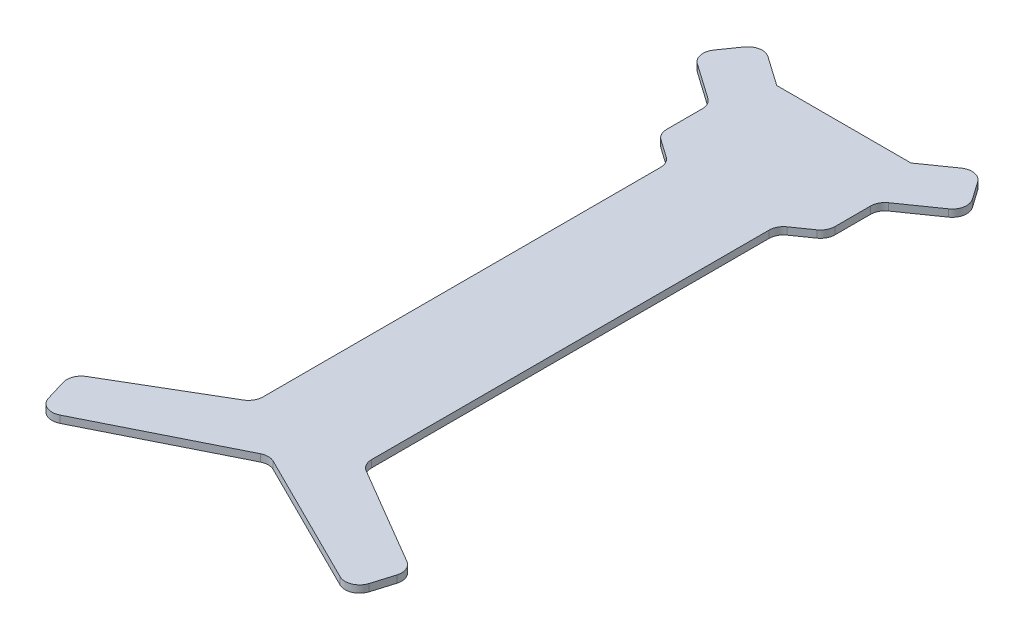
from build123d import *

# Parameters (mm, degrees)
BOSS_EXTRUDE1_DEPTH = 5


with BuildPart() as part:
    # Sketch2 → Boss-Extrude1 (new body)
    with BuildSketch(Plane(origin=(0, 0, 0), x_dir=(1, 0, 0), z_dir=(0, 1, 0))):
        with BuildLine():
            Line((-46.361864593, 80.672065662), (46.361864593, 80.672065662))
            Line((46.361864593, 80.672065662), (66.733304285, 94.936301299))
            ThreePointArc((66.733304285, 94.936301299), (74.205550425, 96.592858386), (80.660589091, 92.480545219))
            Line((80.660589091, 92.480545219), (89.264235636, 80.193264555))
            ThreePointArc((89.264235636, 80.193264555), (90.920792724, 72.721018415), (86.808479557, 66.265979749))
            Line((86.808479557, 66.265979749), (62.402393643, 49.176654414))
            ThreePointArc((62.402393643, 49.176654414), (59.268049675, 45.602620103), (58.138158007, 40.985133971))
            Line((58.138158007, 40.985133971), (58.138158007, 16.396474982))
            ThreePointArc((58.138158007, 16.396474982), (57.008266339, 11.77898885), (53.873922371, 8.204954539))
            Line((53.873922371, 8.204954539), (41.764235636, -0.274339397))
            ThreePointArc((41.764235636, -0.274339397), (38.629891668, -3.848373708), (37.5, -8.46585984))
            Line((37.5, -8.46585984), (37.5, -283.0815533))
            ThreePointArc((37.5, -283.0815533), (38.82037806, -288.047856048), (42.432832597, -291.702679358))
            Line((42.432832597, -291.702679358), (110.719624802, -331.839038015))
            ThreePointArc((110.719624802, -331.839038015), (114.964915466, -336.816247945), (115.224929316, -343.352875846))
            Line((115.224929316, -343.352875846), (110.804845639, -357.979679412))
            ThreePointArc((110.804845639, -357.979679412), (105.193270142, -364.269086107), (96.767619692, -364.034926706))
            Line((96.767619692, -364.034926706), (4.46475403, -317.978659754))
            ThreePointArc((4.46475403, -317.978659754), (0, -316.92661882), (-4.46475403, -317.978659754))
            Line((-4.46475403, -317.978659754), (-96.767619692, -364.034926706))
            ThreePointArc((-96.767619692, -364.034926706), (-105.193270142, -364.269086107), (-110.804845639, -357.979679412))
            Line((-110.804845639, -357.979679412), (-115.224929316, -343.352875846))
            ThreePointArc((-115.224929316, -343.352875846), (-114.964915466, -336.816247945), (-110.719624802, -331.839038015))
            Line((-110.719624802, -331.839038015), (-42.432832597, -291.702679358))
            ThreePointArc((-42.432832597, -291.702679358), (-38.82037806, -288.047856048), (-37.5, -283.0815533))
            Line((-37.5, -283.0815533), (-37.5, -8.46585984))
            ThreePointArc((-37.5, -8.46585984), (-38.629891668, -3.848373708), (-41.764235636, -0.274339397))
            Line((-41.764235636, -0.274339397), (-53.873922371, 8.204954539))
            ThreePointArc((-53.873922371, 8.204954539), (-57.008266339, 11.77898885), (-58.138158007, 16.396474982))
            Line((-58.138158007, 16.396474982), (-58.138158007, 40.985133971))
            ThreePointArc((-58.138158007, 40.985133971), (-59.268049675, 45.602620103), (-62.402393643, 49.176654414))
            Line((-62.402393643, 49.176654414), (-86.808479557, 66.265979749))
            ThreePointArc((-86.808479557, 66.265979749), (-90.920792724, 72.721018415), (-89.264235636, 80.193264555))
            Line((-89.264235636, 80.193264555), (-80.660589091, 92.480545219))
            ThreePointArc((-80.660589091, 92.480545219), (-74.205550425, 96.592858386), (-66.733304285, 94.936301299))
            Line((-66.733304285, 94.936301299), (-46.361864593, 80.672065662))
        make_face()
    extrude(amount=BOSS_EXTRUDE1_DEPTH)


solid = part.part
